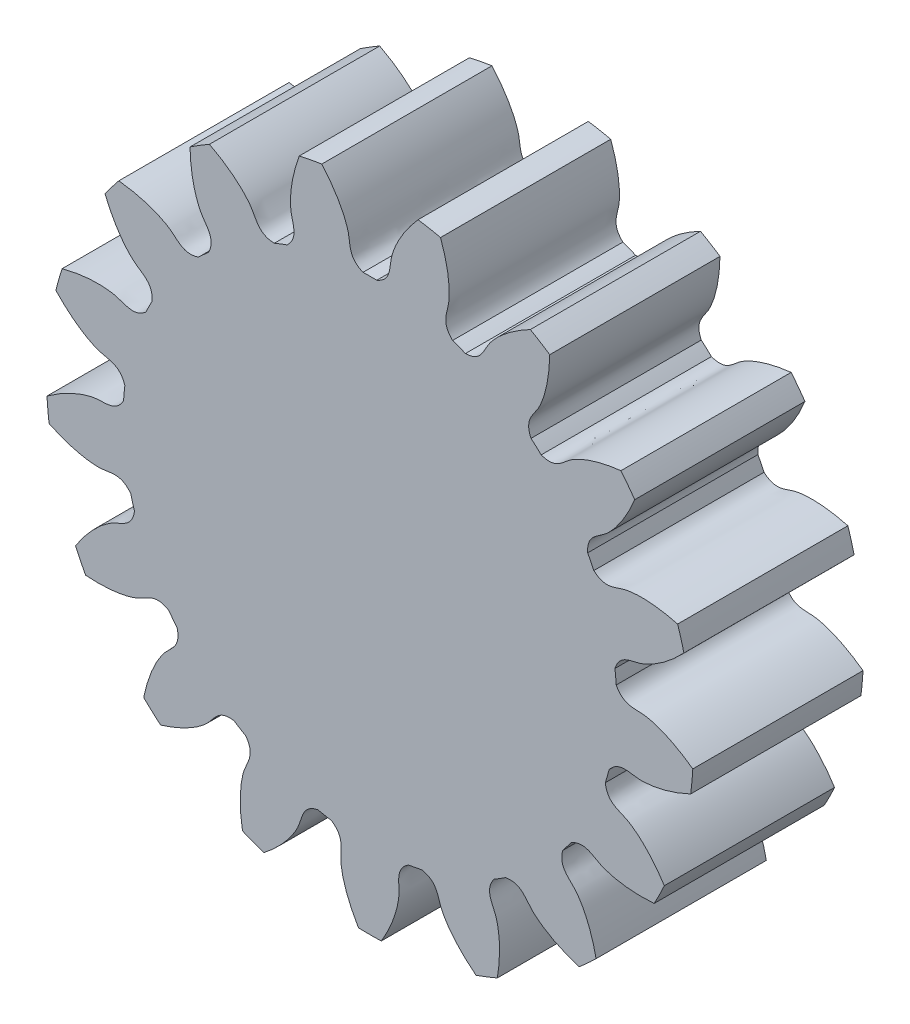
from build123d import *

# Parameters (mm, degrees)
SKETCH_1_R               = 19
EXTRUDE_1_DEPTH          = 10
CUT_EXTRUDE_1_DEPTH      = 29.670542374
PATTERN_CIRCULAR_1_COUNT = 17


with BuildPart() as part:
    # 草图1 → 凸台-拉伸1 (new body)
    with BuildSketch(Plane.XY):
        Circle(SKETCH_1_R)
    extrude(amount=EXTRUDE_1_DEPTH)

    # 草图2 → 切除-拉伸1 (cut, through all)
    with BuildSketch(Plane.XY):
        with BuildLine():
            ThreePointArc((0.403387494, 14.494387829), (0, 14.5), (-0.403387494, 14.494387829))
            add(Edge.make_bspline(
                [(-0.403387494, 14.494387829), (-1.255759481, 14.849644042), (-1.132390756, 15.509626813), (-1.276611209, 16.129648275), (-1.289951469, 16.18230119), (-1.306037005, 16.240838627), (-1.32510118, 16.305170665), (-1.347383555, 16.375198727), (-1.373118159, 16.450817515), (-1.40253689, 16.531914502), (-1.435868224, 16.618370188), (-1.473337358, 16.710058129), (-1.515165928, 16.80684504), (-1.561571855, 16.908590882), (-1.612769151, 17.015148962), (-1.66896775, 17.12636603), (-1.730373323, 17.242082389), (-1.797187111, 17.362132), (-1.869605751, 17.4863426), (-1.947821109, 17.61453582), (-2.032020115, 17.746527309), (-2.1223846, 17.882126855), (-2.219091138, 18.021138524), (-2.32231089, 18.163360791), (-2.432209452, 18.308586678), (-2.548946705, 18.456603899), (-2.67267667, 18.607195006), (-2.803547366, 18.760137539), (-2.941700674, 18.915204179), (-3.087272199, 19.072162909), (-3.24039114, 19.23077717), (-3.401180166, 19.390806026), (-3.569755292, 19.552004336), (-3.746225758, 19.71412292), (-3.930693918, 19.876908731), (-4.123255131, 20.040105038), (-4.323997649, 20.203451599), (-4.533002522, 20.366684847), (-4.750343497, 20.529538073), (-4.976086928, 20.691741613), (-5.210291694, 20.853023038), (-5.453009069, 21.013107349), (-5.79164327, 21.226861067), (-6.053153804, 21.381051942), (-6.231291666, 21.481438237)],
                knots=[0, 0, 0, 0, 0.193882922, 0.199023975, 0.204850501, 0.211362501, 0.218559975, 0.226442923, 0.235011345, 0.24426524, 0.254204608, 0.264829451, 0.276139767, 0.288135557, 0.300816821, 0.314183558, 0.328235769, 0.342973453, 0.358396612, 0.374505244, 0.39129935, 0.408778929, 0.426943982, 0.445794509, 0.46533051, 0.485551984, 0.506458932, 0.528051354, 0.550329249, 0.573292619, 0.596941461, 0.621275778, 0.646295568, 0.672000832, 0.69839157, 0.725467781, 0.753229466, 0.781676625, 0.810809257, 0.840627364, 0.871130943, 0.902319997, 0.934194524, 1, 1, 1, 1], degree=3))
            ThreePointArc((-6.231291666, 21.481438237), (0, 22.366966369), (6.231291666, 21.481438237))
            add(Edge.make_bspline(
                [(0.403387494, 14.494387829), (1.255759481, 14.849644042), (1.132390756, 15.509626813), (1.276611209, 16.129648275), (1.289951469, 16.18230119), (1.306037005, 16.240838627), (1.32510118, 16.305170665), (1.347383555, 16.375198727), (1.373118159, 16.450817515), (1.40253689, 16.531914502), (1.435868224, 16.618370188), (1.473337358, 16.710058129), (1.515165928, 16.80684504), (1.561571855, 16.908590882), (1.612769151, 17.015148962), (1.66896775, 17.12636603), (1.730373323, 17.242082389), (1.797187111, 17.362132), (1.869605751, 17.4863426), (1.947821109, 17.61453582), (2.032020115, 17.746527309), (2.1223846, 17.882126855), (2.219091138, 18.021138524), (2.32231089, 18.163360791), (2.432209452, 18.308586678), (2.548946705, 18.456603899), (2.67267667, 18.607195006), (2.803547366, 18.760137539), (2.941700674, 18.915204179), (3.087272199, 19.072162909), (3.24039114, 19.23077717), (3.401180166, 19.390806026), (3.569755292, 19.552004336), (3.746225758, 19.71412292), (3.930693918, 19.876908731), (4.123255131, 20.040105038), (4.323997649, 20.203451599), (4.533002522, 20.366684847), (4.750343497, 20.529538073), (4.976086928, 20.691741613), (5.210291694, 20.853023038), (5.453009069, 21.013107349), (5.79164327, 21.226861067), (6.053153804, 21.381051942), (6.231291666, 21.481438237)],
                knots=[0, 0, 0, 0, 0.193882922, 0.199023975, 0.204850501, 0.211362501, 0.218559975, 0.226442923, 0.235011345, 0.24426524, 0.254204608, 0.264829451, 0.276139767, 0.288135557, 0.300816821, 0.314183558, 0.328235769, 0.342973453, 0.358396612, 0.374505244, 0.39129935, 0.408778929, 0.426943982, 0.445794509, 0.46533051, 0.485551984, 0.506458932, 0.528051354, 0.550329249, 0.573292619, 0.596941461, 0.621275778, 0.646295568, 0.672000832, 0.69839157, 0.725467781, 0.753229466, 0.781676625, 0.810809257, 0.840627364, 0.871130943, 0.902319997, 0.934194524, 1, 1, 1, 1], degree=3))
        make_face()
    cut_extrude_1 = extrude(amount=CUT_EXTRUDE_1_DEPTH, mode=Mode.SUBTRACT)

    # 阵列(圆周)1: 切除-拉伸1 ×17 about axis
    pattern_circular_1_axis = Axis((0, 0, -0.5), (0, 0, 1))
    for i in range(1, PATTERN_CIRCULAR_1_COUNT):
        add(cut_extrude_1.rotate(pattern_circular_1_axis, i * 360 / PATTERN_CIRCULAR_1_COUNT), mode=Mode.SUBTRACT)


solid = part.part
